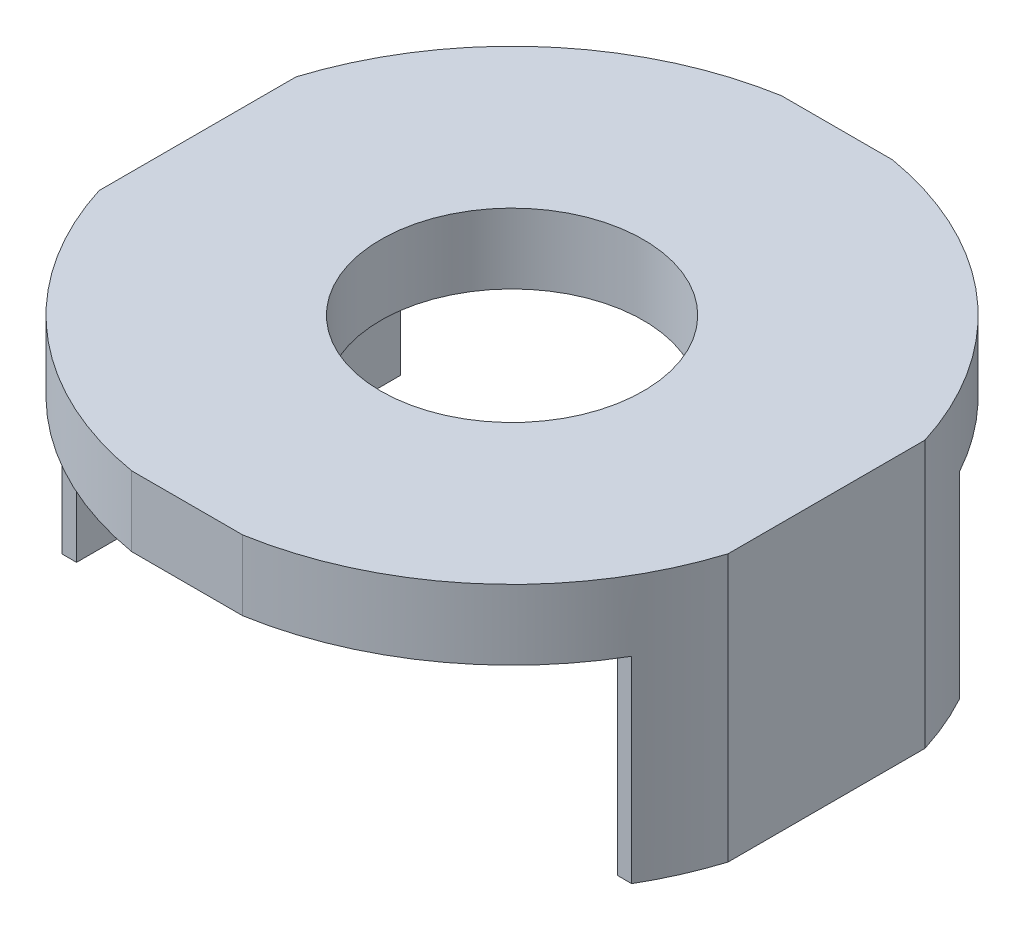
from build123d import *

# Parameters (mm, degrees)
SKETCH1_R           = 3
BOSS_EXTRUDE1_DEPTH = 1.6
BOSS_EXTRUDE3_START = 4.5
BOSS_EXTRUDE3_DEPTH = 4.5


with BuildPart() as part:
    # Sketch1 → Boss-Extrude1 (new body)
    with BuildSketch(Plane(origin=(0, 0, 0), x_dir=(1, 0, 0), z_dir=(0, 1, 0))):
        with BuildLine():
            Line((1.268248439, -7.422428571), (-1.268248439, -7.422428571))
            ThreePointArc((-1.268248439, -7.422428571), (-4.955504601, -5.669556786), (-7.185986362, -2.25))
            Line((-7.185986362, -2.25), (-7.185986362, 2.25))
            ThreePointArc((-7.185986362, 2.25), (-4.955504601, 5.669556786), (-1.268248439, 7.422428571))
            Line((-1.268248439, 7.422428571), (1.268248439, 7.422428571))
            ThreePointArc((1.268248439, 7.422428571), (4.955504601, 5.669556786), (7.185986362, 2.25))
            Line((7.185986362, 2.25), (7.185986362, -2.25))
            ThreePointArc((7.185986362, -2.25), (4.955504601, -5.669556786), (1.268248439, -7.422428571))
        make_face()
        with Locations(Location((0, 0, 0), (0, 0, 270))):
            Circle(SKETCH1_R, mode=Mode.SUBTRACT)
    extrude(amount=BOSS_EXTRUDE1_DEPTH)

    # Sketch2 → Boss-Extrude3 (add)
    with BuildSketch(Plane.XZ.offset(BOSS_EXTRUDE3_START)):
        with BuildLine():
            ThreePointArc((-7.185986362, -2.25), (-6.924787857, -2.957737841), (-6.594083964, -3.635788316))
            Line((-6.594083964, -3.635788316), (-6.185986362, -3.635788316))
            Line((-6.185986362, -3.635788316), (-6.185986362, 3.764211684))
            Line((-6.185986362, 3.764211684), (-6.521626362, 3.764211684))
            ThreePointArc((-6.521626362, 3.764211684), (-6.895496422, 3.025397345), (-7.185986362, 2.25))
            Line((-7.185986362, 2.25), (-7.185986362, -2.25))
        make_face()
        with BuildLine():
            Line((6.185986362, -3.620011298), (6.602758378, -3.620011298))
            ThreePointArc((6.602758378, -3.620011298), (6.928318925, -2.949457048), (7.185986362, -2.25))
            Line((7.185986362, -2.25), (7.185986362, 2.25))
            ThreePointArc((7.185986362, 2.25), (6.891829312, 3.033741706), (6.512494562, 3.779988702))
            Line((6.512494562, 3.779988702), (6.185986362, 3.779988702))
            Line((6.185986362, 3.779988702), (6.185986362, -3.620011298))
        make_face()
    extrude(amount=-BOSS_EXTRUDE3_DEPTH)


solid = part.part
